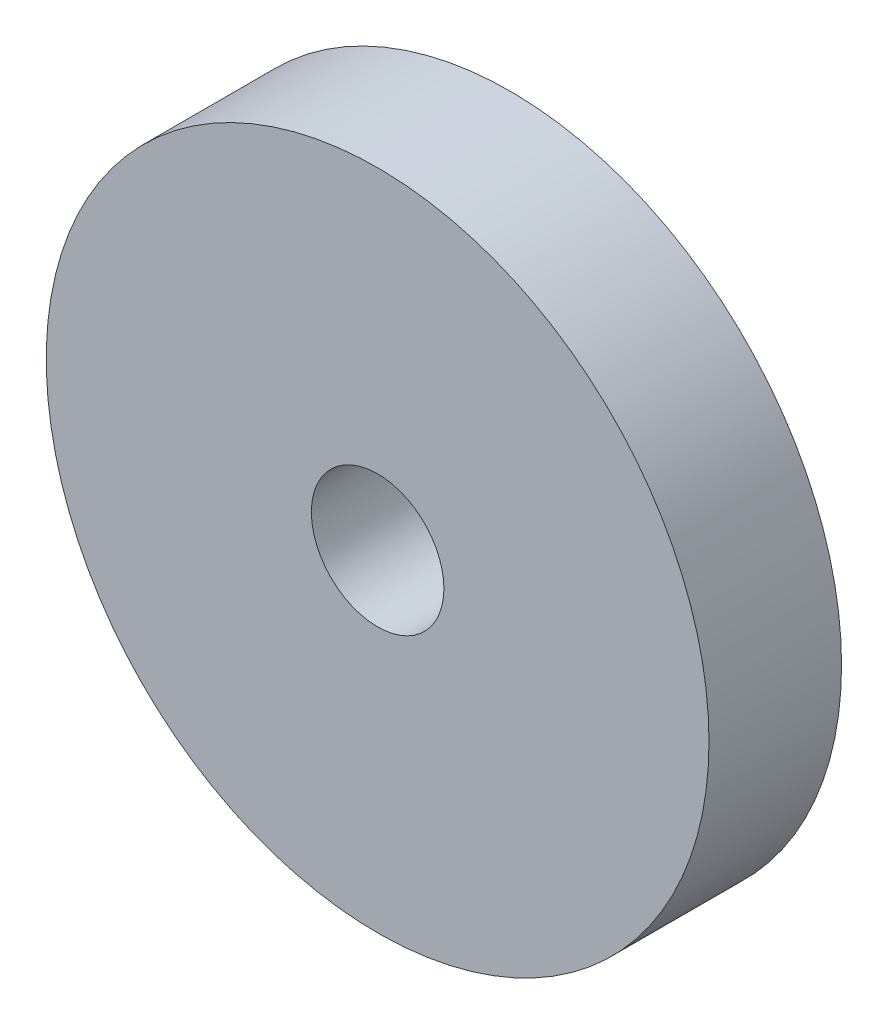
from build123d import *

# Parameters (mm, degrees)
SKETCH1_R           = 50
SKETCH1_R_2         = 10
BOSS_EXTRUDE1_DEPTH = 20


with BuildPart() as part:
    # Sketch1 → Boss-Extrude1 (new body)
    with BuildSketch(Plane.XY):
        Circle(SKETCH1_R)
        Circle(SKETCH1_R_2, mode=Mode.SUBTRACT)
    extrude(amount=BOSS_EXTRUDE1_DEPTH)


solid = part.part
